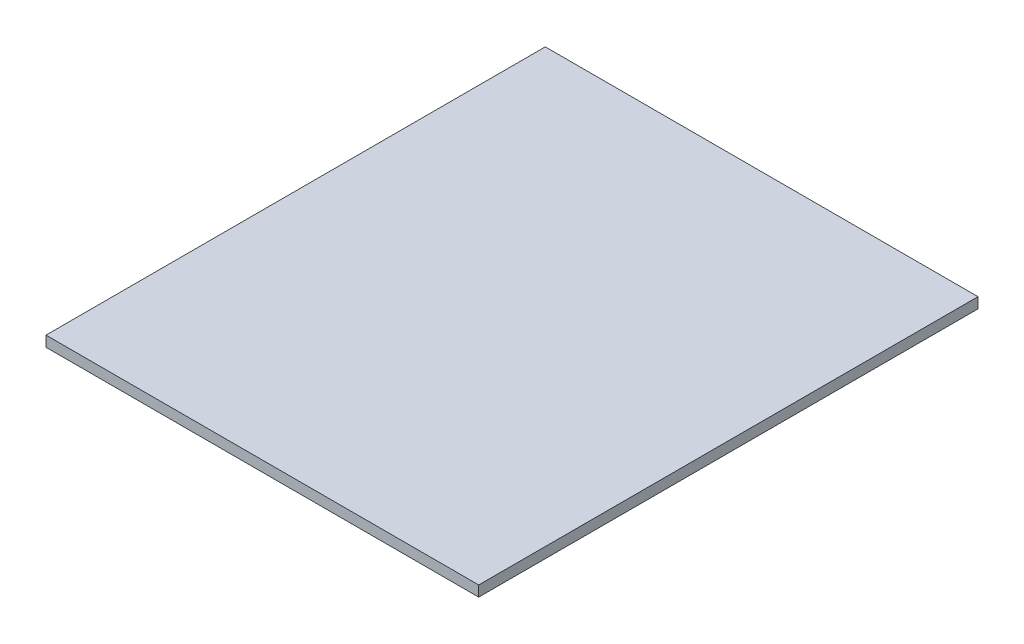
from build123d import *

# Parameters (mm, degrees)
SKETCH1_W           = 130
SKETCH1_H           = 150
BOSS_EXTRUDE1_DEPTH = 3.175


with BuildPart() as part:
    # Sketch1 → Boss-Extrude1 (new body)
    with BuildSketch(Plane(origin=(0, 0, 0), x_dir=(1, 0, 0), z_dir=(0, 1, 0))):
        with Locations((65, 75)):
            Rectangle(SKETCH1_W, SKETCH1_H)
    extrude(amount=BOSS_EXTRUDE1_DEPTH)


solid = part.part
